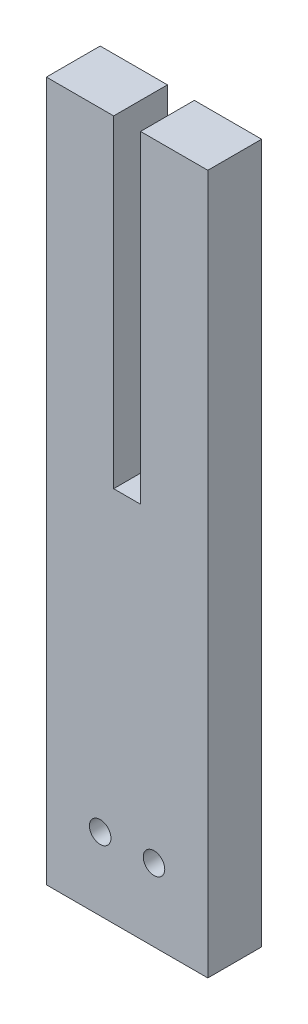
from build123d import *

# Parameters (mm, degrees)
ESBO_O1_W                = 30
ESBO_O1_H                = 140
RESSALTO_EXTRUS_O1_DEPTH = 10
CORTE_EXTRUS_O1_REACH    = 74.284
ESBO_O2_R                = 2
CORTE_EXTRUS_O2_REACH    = 78.811
ESBO_O3_W                = 10
ESBO_O3_H                = 10
CORTE_EXTRUS_O3_REACH    = 74.284
ESBO_O4_W                = 5
ESBO_O4_H                = 60


with BuildPart() as part:
    # Esboço1 → Ressalto-extrusão1 (new body)
    with BuildSketch(Plane.XY):
        Rectangle(ESBO_O1_W, ESBO_O1_H)
    extrude(amount=RESSALTO_EXTRUS_O1_DEPTH)

    # Esboço2 → Corte-extrusão1 (cut, up to next)
    with BuildSketch(Plane.XY.offset(10), mode=Mode.PRIVATE) as corte_extrus_o1_sk1:
        with Locations((-5, -56.5)):
            Circle(ESBO_O2_R)
    corte_extrus_o1_tool1 = extrude(corte_extrus_o1_sk1.sketch, amount=-CORTE_EXTRUS_O1_REACH, mode=Mode.PRIVATE) & part.part
    # Esboço2 → Corte-extrusão1 (cut, up to next)
    with BuildSketch(Plane.XY.offset(10), mode=Mode.PRIVATE) as corte_extrus_o1_sk2:
        with Locations((5, -56.5)):
            Circle(ESBO_O2_R)
    corte_extrus_o1_tool2 = extrude(corte_extrus_o1_sk2.sketch, amount=-CORTE_EXTRUS_O1_REACH, mode=Mode.PRIVATE) & part.part
    add(corte_extrus_o1_tool1.solids().sort_by_distance((-5, -56.5, 10))[0], mode=Mode.SUBTRACT)
    add(corte_extrus_o1_tool2.solids().sort_by_distance((5, -56.5, 10))[0], mode=Mode.SUBTRACT)

    # Esboço3 → Corte-extrusão2 (cut, up to next)
    with BuildSketch(Plane(origin=(15, 0, 0), x_dir=(0, 0, -1), z_dir=(1, 0, 0)), mode=Mode.PRIVATE) as corte_extrus_o2_sk1:
        with Locations((-5, 65)):
            Rectangle(ESBO_O3_W, ESBO_O3_H)
    corte_extrus_o2_tool1 = extrude(corte_extrus_o2_sk1.sketch, amount=-CORTE_EXTRUS_O2_REACH, mode=Mode.PRIVATE) & part.part
    add(corte_extrus_o2_tool1.solids().sort_by_distance((15, 65, 5))[0], mode=Mode.SUBTRACT)

    # Esboço4 → Corte-extrusão3 (cut, up to next)
    with BuildSketch(Plane.XY.offset(10), mode=Mode.PRIVATE) as corte_extrus_o3_sk1:
        with Locations((0, 30)):
            Rectangle(ESBO_O4_W, ESBO_O4_H)
    corte_extrus_o3_tool1 = extrude(corte_extrus_o3_sk1.sketch, amount=-CORTE_EXTRUS_O3_REACH, mode=Mode.PRIVATE) & part.part
    add(corte_extrus_o3_tool1.solids().sort_by_distance((0, 30, 10))[0], mode=Mode.SUBTRACT)


solid = part.part
